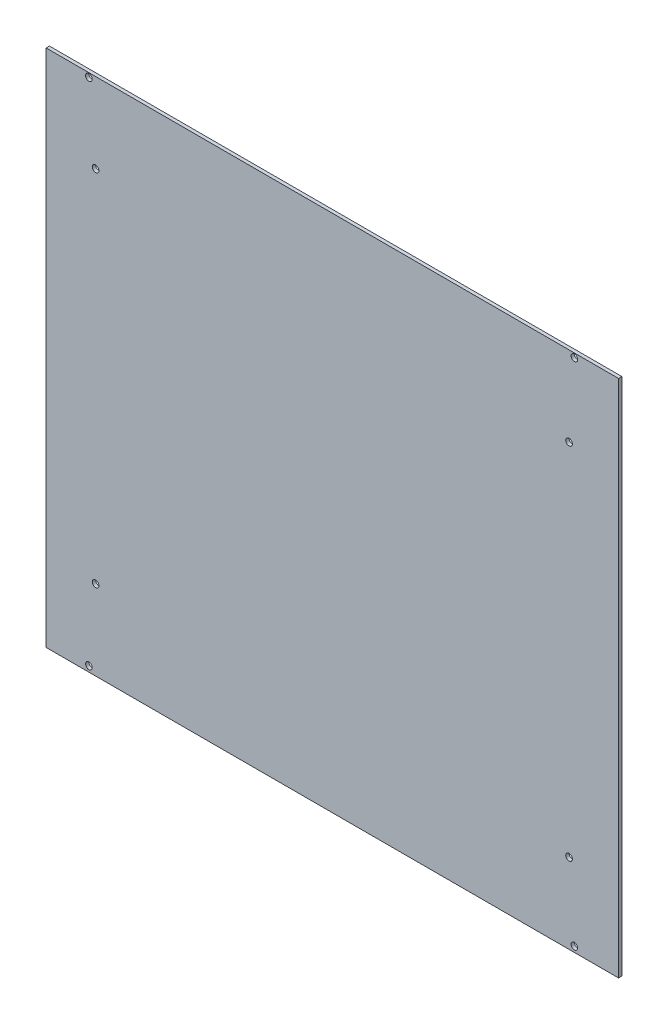
from build123d import *

# Parameters (mm, degrees)
SKETCH1_W           = 546.1
SKETCH1_H           = 495.3
BOSS_EXTRUDE1_DEPTH = 3.175
SKETCH3_R           = 3.175
CUT_EXTRUDE2_DEPTH  = 3.175
SKETCH6_R           = 3.175
CUT_EXTRUDE3_DEPTH  = 6.35


with BuildPart() as part:
    # Sketch1 → Boss-Extrude1 (new body)
    with BuildSketch(Plane.XY):
        Rectangle(SKETCH1_W, SKETCH1_H)
    extrude(amount=BOSS_EXTRUDE1_DEPTH)

    # Sketch3 → Cut-Extrude2 (cut)
    with BuildSketch(Plane.XY.offset(3.175)):
        with Locations((-225.806, 171.45)):
            Circle(SKETCH3_R)
        with Locations(Location((225.806, 171.45, 0), (0, 0, 180))):
            Circle(SKETCH3_R)
        with Locations((225.806, -171.45)):
            Circle(SKETCH3_R)
        with Locations(Location((-225.806, -171.45, 0), (0, 0, 180))):
            Circle(SKETCH3_R)
    extrude(amount=-CUT_EXTRUDE2_DEPTH, mode=Mode.SUBTRACT)

    # Sketch6 → Cut-Extrude3 (cut)
    with BuildSketch(Plane(origin=(0, 0, 0), x_dir=(-1, 0, 0), z_dir=(0, 0, -1))):
        with Locations((-230.894832538, -242.410608142)):
            Circle(SKETCH6_R)
        with Locations(Location((-230.894832538, 243.724649044, 0), (0, 0, 180))):
            Circle(SKETCH6_R)
        with Locations(Location((232.20887344, -242.410608142, 0), (0, 0, 180))):
            Circle(SKETCH6_R)
        with Locations((232.20887344, 243.724649044)):
            Circle(SKETCH6_R)
    extrude(amount=-CUT_EXTRUDE3_DEPTH, mode=Mode.SUBTRACT)


solid = part.part
